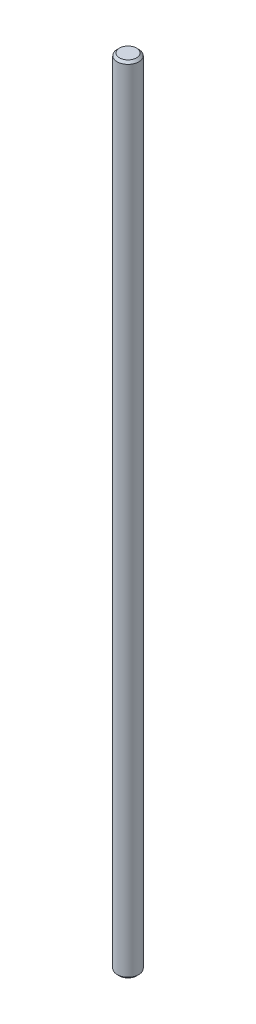
from build123d import *

# Parameters (mm, degrees)
M4_DIAMETER_SKETCH_R = 1.9
BOSS_EXTRUDE1_DEPTH  = 140
CHAMFER1_SIZE        = 0.4


with BuildPart() as part:
    # m4 diameter sketch → Boss-Extrude1 (new body)
    with BuildSketch(Plane(origin=(0, 0, 0), x_dir=(1, 0, 0), z_dir=(0, 1, 0))):
        with Locations(Location((0, 0, 0), (0, 0, 270))):
            Circle(M4_DIAMETER_SKETCH_R)
    extrude(amount=BOSS_EXTRUDE1_DEPTH)

    # Chamfer1
    chamfer1_edges = [part.edges().sort_by_distance(p)[0] for p in [
        (0, 0, -1.9),
        (0, 140, -1.9),
    ]]
    chamfer(chamfer1_edges, length=CHAMFER1_SIZE)


solid = part.part
